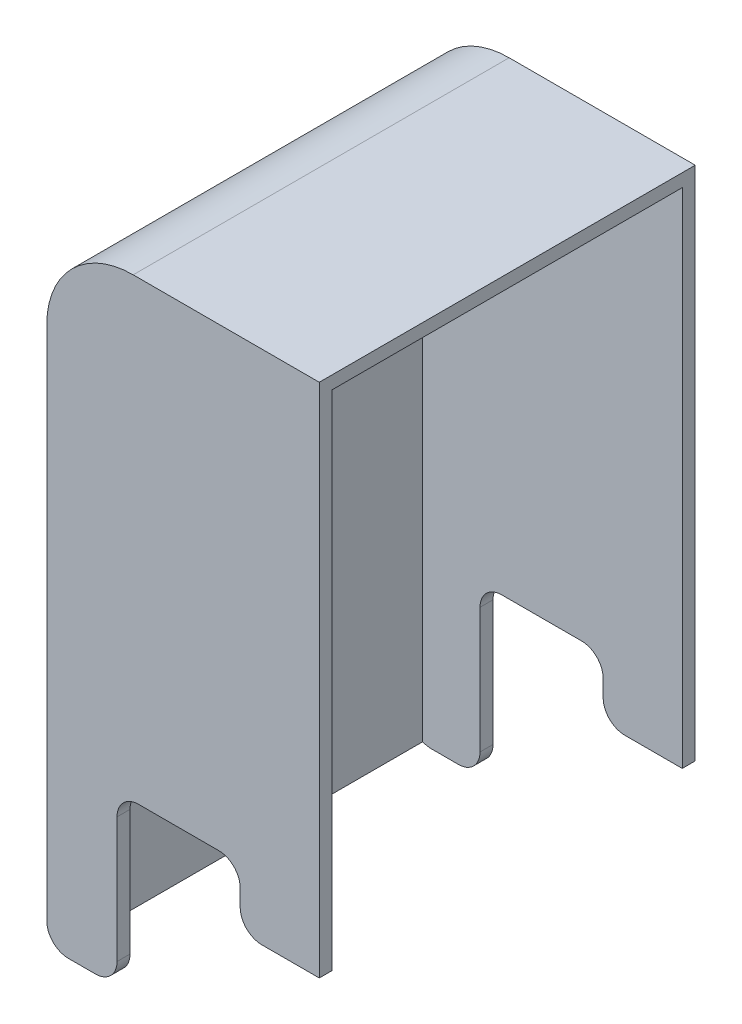
from build123d import *

# Parameters (mm, degrees)
BOSS_EXTRUDE1_DEPTH = 1.5
BOSS_EXTRUDE2_DEPTH = 81
BOSS_EXTRUDE3_DEPTH = 3


with BuildPart() as part:
    # Sketch1 → Boss-Extrude1 (new, symmetric)
    with BuildSketch(Plane.XY):
        with BuildLine():
            Line((31.56, -47.50625778), (31.56, 71.89374222))
            Line((31.56, 71.89374222), (-11.5, 71.89374222))
            ThreePointArc((-11.5, 71.89374222), (-25.642135624, 66.035877844), (-31.5, 51.89374222))
            Line((-31.5, 51.89374222), (-31.5, -67.60625778))
            ThreePointArc((-31.5, -67.60625778), (-30.035533906, -71.141791686), (-26.5, -72.60625778))
            Line((-26.5, -72.60625778), (-20.24, -72.60625778))
            ThreePointArc((-20.24, -72.60625778), (-16.704466094, -71.141791686), (-15.24, -67.60625778))
            Line((-15.24, -67.60625778), (-15.24, -38.60625778))
            ThreePointArc((-15.24, -38.60625778), (-13.775533906, -35.070723874), (-10.24, -33.60625778))
            Line((-10.24, -33.60625778), (8.26, -33.60625778))
            ThreePointArc((8.26, -33.60625778), (11.795533906, -35.070723874), (13.26, -38.60625778))
            Line((13.26, -38.60625778), (13.26, -42.50625778))
            ThreePointArc((13.26, -42.50625778), (14.724466094, -46.041791686), (18.26, -47.50625778))
            Line((18.26, -47.50625778), (31.56, -47.50625778))
        make_face()
    extrude(amount=BOSS_EXTRUDE1_DEPTH, both=True)

    # Sketch2 → Boss-Extrude2 (add)
    with BuildSketch(Plane(origin=(0, 0, -1.5), x_dir=(-1, 0, 0), z_dir=(0, 0, -1))):
        with BuildLine():
            Line((28.5, -67.60625778), (28.5, 51.89374222))
            ThreePointArc((28.5, 51.89374222), (23.52081528, 63.9145575), (11.5, 68.89374222))
            Line((11.5, 68.89374222), (-28.56, 68.89374222))
            Line((-28.56, 68.89374222), (-31.56, 68.89374222))
            Line((-31.56, 68.89374222), (-31.56, 71.89374222))
            Line((-31.56, 71.89374222), (11.5, 71.89374222))
            ThreePointArc((11.5, 71.89374222), (25.642135624, 66.035877844), (31.5, 51.89374222))
            Line((31.5, 51.89374222), (31.5, -67.60625778))
            ThreePointArc((31.5, -67.60625778), (30.683300133, -70.344870568), (28.5, -72.188833475))
            Line((28.5, -72.188833475), (28.5, -67.60625778))
        make_face()
    extrude(amount=BOSS_EXTRUDE2_DEPTH)

    # Sketch3 → Boss-Extrude3 (add)
    with BuildSketch(Plane(origin=(0, 0, -82.5), x_dir=(-1, 0, 0), z_dir=(0, 0, -1))):
        with BuildLine():
            Line((-31.56, 68.89374222), (-31.56, 71.89374222))
            Line((-31.56, 71.89374222), (11.5, 71.89374222))
            ThreePointArc((11.5, 71.89374222), (25.642135624, 66.035877844), (31.5, 51.89374222))
            Line((31.5, 51.89374222), (31.5, -67.60625778))
            ThreePointArc((31.5, -67.60625778), (30.683300133, -70.344870568), (28.5, -72.188833475))
            ThreePointArc((28.5, -72.188833475), (27.521548218, -72.500789345), (26.5, -72.60625778))
            Line((26.5, -72.60625778), (20.24, -72.60625778))
            ThreePointArc((20.24, -72.60625778), (16.704466094, -71.141791686), (15.24, -67.60625778))
            Line((15.24, -67.60625778), (15.24, -38.60625778))
            ThreePointArc((15.24, -38.60625778), (13.775533906, -35.070723874), (10.24, -33.60625778))
            Line((10.24, -33.60625778), (-8.26, -33.60625778))
            ThreePointArc((-8.26, -33.60625778), (-11.795533906, -35.070723874), (-13.26, -38.60625778))
            Line((-13.26, -38.60625778), (-13.26, -42.50625778))
            ThreePointArc((-13.26, -42.50625778), (-14.724466094, -46.041791686), (-18.26, -47.50625778))
            Line((-18.26, -47.50625778), (-31.56, -47.50625778))
            Line((-31.56, -47.50625778), (-31.56, 68.89374222))
        make_face()
    extrude(amount=BOSS_EXTRUDE3_DEPTH)


solid = part.part
